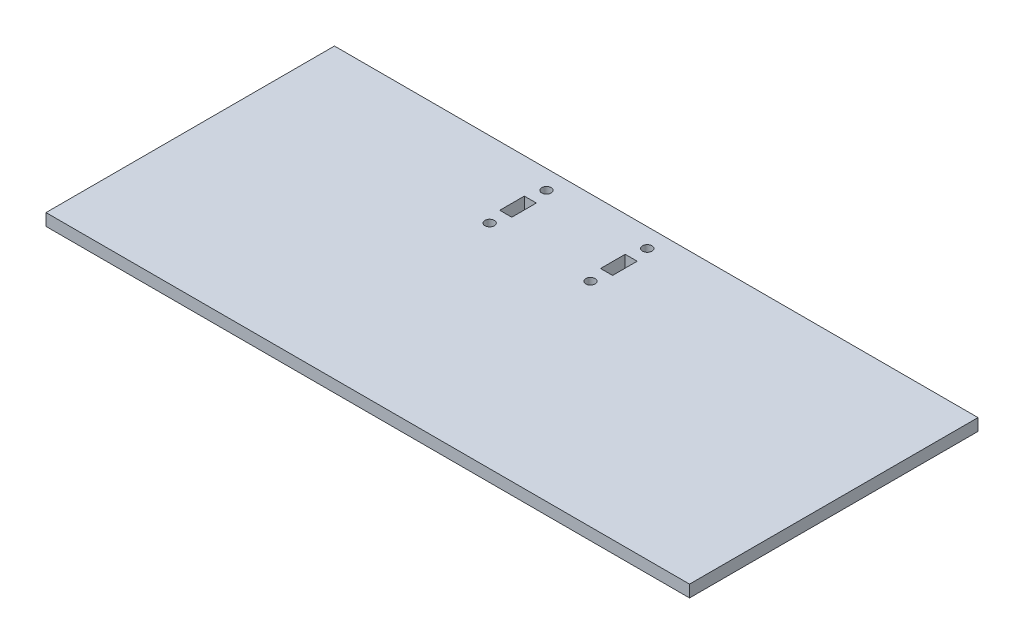
from build123d import *

# Parameters (mm, degrees)
SKETCH1_W           = 340
SKETCH1_H           = 152.4
SKETCH1_R           = 2.4892
SKETCH1_W_2         = 6.35
SKETCH1_H_2         = 13
BOSS_EXTRUDE1_DEPTH = 6.35


with BuildPart() as part:
    # Sketch1 → Boss-Extrude1 (new body)
    with BuildSketch(Plane(origin=(0, 0, 0), x_dir=(1, 0, 0), z_dir=(0, 1, 0))):
        with Locations((170, 76.2)):
            Rectangle(SKETCH1_W, SKETCH1_H)
        with Locations(Location((122, 142.399999934, 0), (0, 0, 270))):
            Circle(SKETCH1_R, mode=Mode.SUBTRACT)
        with Locations(Location((175.260007, 142.399999934, 0), (0, 0, 270))):
            Circle(SKETCH1_R, mode=Mode.SUBTRACT)
        with Locations(Location((122, 112.39999999, 0), (0, 0, 270))):
            Circle(SKETCH1_R, mode=Mode.SUBTRACT)
        with Locations(Location((175.260007, 112.39999999, 0), (0, 0, 270))):
            Circle(SKETCH1_R, mode=Mode.SUBTRACT)
        with Locations((122, 127.399999934)):
            Rectangle(SKETCH1_W_2, SKETCH1_H_2, mode=Mode.SUBTRACT)
        with Locations((175.260007, 127.399999934)):
            Rectangle(SKETCH1_W_2, SKETCH1_H_2, mode=Mode.SUBTRACT)
    extrude(amount=BOSS_EXTRUDE1_DEPTH)


solid = part.part
